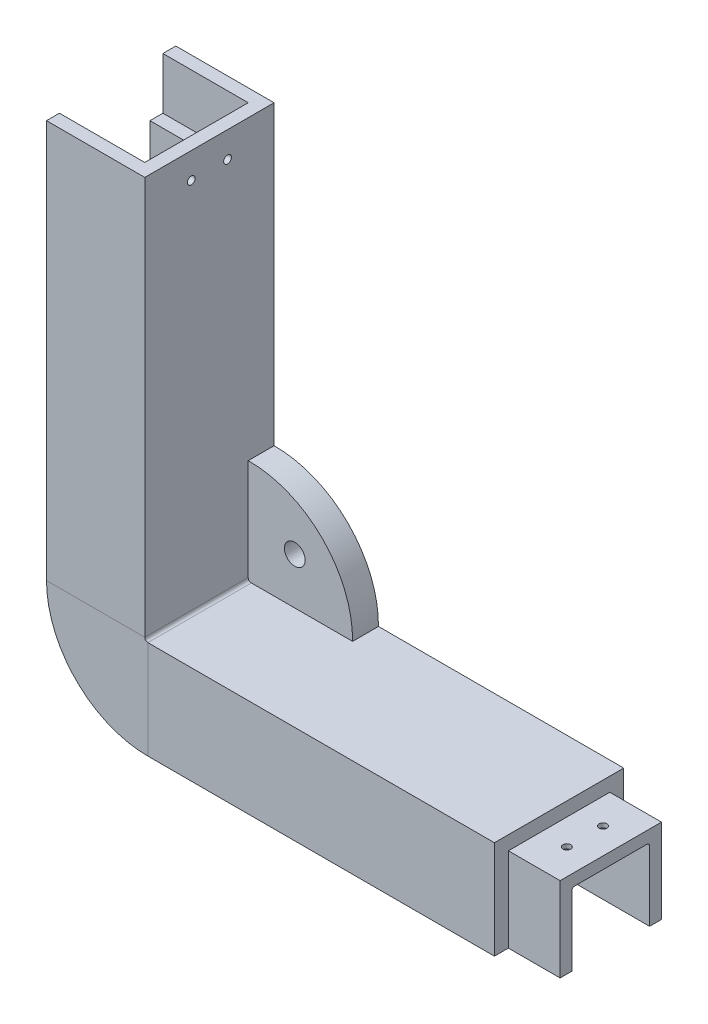
from build123d import *

# Parameters (mm, degrees)
BOSS_EXTRUDE2_START  = 12.7
BOSS_EXTRUDE2_DEPTH  = 12.7
BOSS_EXTRUDE3_DEPTH  = 12.7
SKETCH8_R            = 0.9525
CUT_EXTRUDE1_DEPTH   = 146.526980066
SKETCH9_R            = 0.9525
CUT_EXTRUDE2_DEPTH   = 152.345956246
SKETCH12_R           = 2.5527
BOSS_EXTRUDE10_DEPTH = 6.35


with BuildPart() as part:
    # Sweep1: sweep along a path in Sketch4
    with BuildLine(Plane.XY) as sweep1_path:
        Line((0, 0), (0, -85.09))
        ThreePointArc((0, -85.09), (0.223184633, -85.628815367), (0.762, -85.852))
        Line((0.762, -85.852), (85.852, -85.852))
    # Sketch3 → Sweep1 (sweep)
    with BuildSketch(Plane(origin=(0, 0, 0), x_dir=(1, 0, 0), z_dir=(0, 1, 0))):
        with BuildLine():
            Line((0, 10.27500014), (-24.13, 10.27500014))
            Line((-24.13, 10.27500014), (-24.13, 3.92500014))
            Line((-24.13, 3.92500014), (-6.985, 3.92500014))
            ThreePointArc((-6.985, 3.92500014), (-6.535987194, 3.739012946), (-6.35, 3.29000014))
            Line((-6.35, 3.29000014), (-6.35, -14.48999986))
            ThreePointArc((-6.35, -14.48999986), (-6.535987194, -14.939012666), (-6.985, -15.12499986))
            Line((-6.985, -15.12499986), (-24.13, -15.12499986))
            Line((-24.13, -15.12499986), (-24.13, -21.47499986))
            Line((-24.13, -21.47499986), (0, -21.47499986))
            Line((0, -21.47499986), (0, 10.27500014))
        make_face()
    sweep(path=sweep1_path.line)

    # Sketch6 → Boss-Extrude2 (add)
    with BuildSketch(Plane(origin=(85.852, 0, 0), x_dir=(0, 0, -1), z_dir=(1, 0, 0)).offset(BOSS_EXTRUDE2_START)):
        with BuildLine():
            Line((-18.04599986, -89.281), (6.84600014, -89.281))
            Line((6.84600014, -89.281), (6.84600014, -109.982))
            Line((6.84600014, -109.982), (3.92500014, -109.982))
            Line((3.92500014, -109.982), (3.92500014, -92.837))
            ThreePointArc((3.92500014, -92.837), (3.739012946, -92.387987194), (3.29000014, -92.202))
            Line((3.29000014, -92.202), (-14.48999986, -92.202))
            ThreePointArc((-14.48999986, -92.202), (-14.939012666, -92.387987194), (-15.12499986, -92.837))
            Line((-15.12499986, -92.837), (-15.12499986, -109.982))
            Line((-15.12499986, -109.982), (-18.04599986, -109.982))
            Line((-18.04599986, -109.982), (-18.04599986, -89.281))
        make_face()
    extrude(amount=-BOSS_EXTRUDE2_DEPTH)

    # Sketch7 → Boss-Extrude3 (add)
    with BuildSketch(Plane(origin=(0, 0, 0), x_dir=(1, 0, 0), z_dir=(0, 1, 0))):
        Polygon((-24.13, 7.10000014), (-24.13, 10.27500014), (0, 10.27500014), (0, -21.47499986), (-24.13, -21.47499986), (-24.13, -18.29999986), (-3.175, -18.29999986), (-3.175, 7.10000014), align=None)
    extrude(amount=BOSS_EXTRUDE3_DEPTH)

    # Sketch8 → Cut-Extrude1 (cut, through all)
    with BuildSketch(Plane.XZ.offset(92.202)):
        with Locations(Location((92.202, 10.04499986, 0), (0, 0, 270))):
            Circle(SKETCH8_R)
        with Locations(Location((92.202, 1.15499986, 0), (0, 0, 270))):
            Circle(SKETCH8_R)
    extrude(amount=-CUT_EXTRUDE1_DEPTH, mode=Mode.SUBTRACT)

    # Sketch9 → Cut-Extrude2 (cut, through all)
    with BuildSketch(Plane.ZY.offset(3.175)):
        with Locations((1.15499986, 6.35)):
            Circle(SKETCH9_R)
        with Locations((10.04499986, 6.35)):
            Circle(SKETCH9_R)
    extrude(amount=-CUT_EXTRUDE2_DEPTH, mode=Mode.SUBTRACT)

    # Sketch12 → Boss-Extrude10 (add)
    with BuildSketch(Plane.XY.offset(-10.27500014)):
        with BuildLine():
            Line((0, -60.229795925), (0, -85.09))
            ThreePointArc((0, -85.09), (0.223184633, -85.628815367), (0.762, -85.852))
            Line((0.762, -85.852), (25.622204075, -85.852))
            ThreePointArc((25.622204075, -85.852), (18.183696875, -67.668303125), (0, -60.229795925))
        make_face()
        with Locations((11.43, -74.422)):
            Circle(SKETCH12_R, mode=Mode.SUBTRACT)
    extrude(amount=BOSS_EXTRUDE10_DEPTH)

    # Sketch14 → CSK for _6 Flat Head Machine Screw _100 (revolve, cut)
    with BuildSketch(Plane(origin=(92.202, -92.202, 1.15499986), x_dir=(0, 0, -1), z_dir=(1, 0, 0))):
        Polygon((0, 0), (0, 2.410824014), (1.89865, 1.27), (1.89865, 1.380025208), (3.5433, 0), align=None)
    revolve(axis=Axis((92.202, -98.552, 1.15499986), (0, 1, 0)), mode=Mode.SUBTRACT)

    # Sketch16 → CSK for _6 Flat Head Machine Screw _ 2 (revolve, cut)
    with BuildSketch(Plane(origin=(92.202, -92.202, 10.04499986), x_dir=(0, 0, -1), z_dir=(1, 0, 0))):
        Polygon((0, 0), (0, 2.410824014), (1.89865, 1.27), (1.89865, 1.380025208), (3.5433, 0), align=None)
    revolve(axis=Axis((92.202, -98.552, 10.04499986), (0, 1, 0)), mode=Mode.SUBTRACT)


solid = part.part
